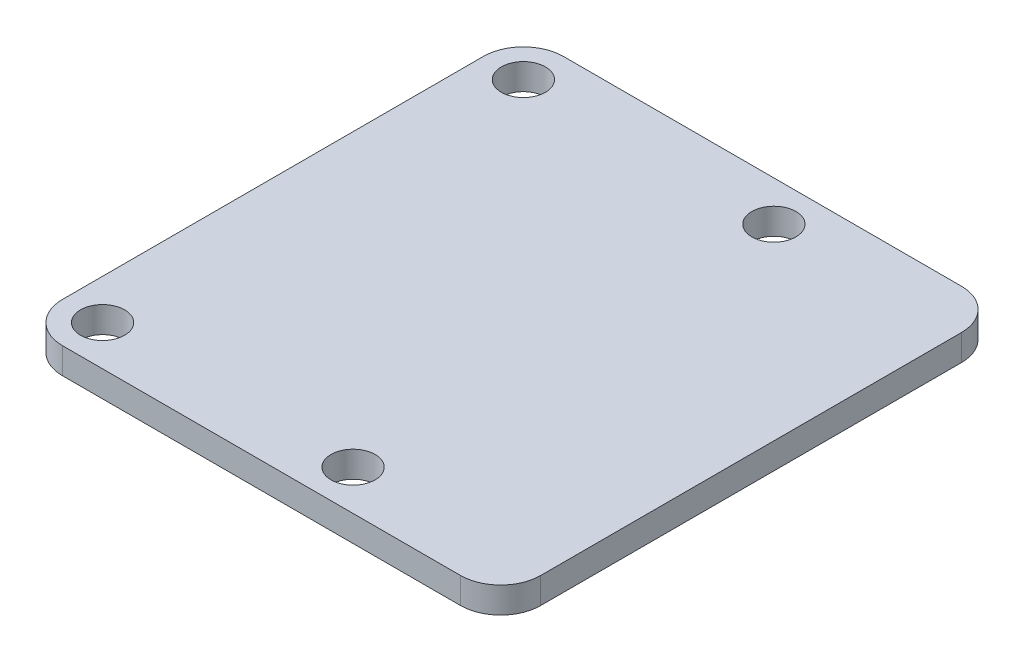
from build123d import *

# Parameters (mm, degrees)
SKETCH1_W           = 23.862
SKETCH1_H           = 25
SKETCH1_R           = 1.1
BOSS_EXTRUDE1_DEPTH = 1.3
SKETCH2_W           = 8
SKETCH2_H           = 8
BOSS_EXTRUDE2_DEPTH = 2
SKETCH3_R           = 3.5
BOSS_EXTRUDE3_DEPTH = 2
FILLET1_R           = 2


with BuildPart() as part:
    # Sketch1 → Boss-Extrude1 (new body)
    with BuildSketch(Plane(origin=(0, 0, 0), x_dir=(1, 0, 0), z_dir=(0, 1, 0))):
        Rectangle(SKETCH1_W, SKETCH1_H)
        with Locations(Location((-9.931, -10.5, 0), (0, 0, 270))):
            Circle(SKETCH1_R, mode=Mode.SUBTRACT)
        with Locations(Location((2.569, -10.5, 0), (0, 0, 270))):
            Circle(SKETCH1_R, mode=Mode.SUBTRACT)
        with Locations(Location((-9.931, 10.5, 0), (0, 0, 270))):
            Circle(SKETCH1_R, mode=Mode.SUBTRACT)
        with Locations(Location((2.569, 10.5, 0), (0, 0, 270))):
            Circle(SKETCH1_R, mode=Mode.SUBTRACT)
    extrude(amount=BOSS_EXTRUDE1_DEPTH)

    # Sketch2 → Boss-Extrude2 (add)
    with BuildSketch(Plane.XZ):
        with Locations((2.469, 0)):
            Rectangle(SKETCH2_W, SKETCH2_H)
    extrude(amount=BOSS_EXTRUDE2_DEPTH)

    # Sketch3 → Boss-Extrude3 (add)
    with BuildSketch(Plane.XZ.offset(2)):
        with Locations(Location((2.469, 0, 0), (0, 0, 90))):
            Circle(SKETCH3_R)
    extrude(amount=BOSS_EXTRUDE3_DEPTH)

    # Fillet1
    fillet1_edges = [part.edges().sort_by_distance(p)[0] for p in [
        (11.931, 0.65, 12.5),
        (-11.931, 0.65, 12.5),
        (-11.931, 0.65, -12.5),
        (11.931, 0.65, -12.5),
    ]]
    fillet(fillet1_edges, radius=FILLET1_R)


solid = part.part
